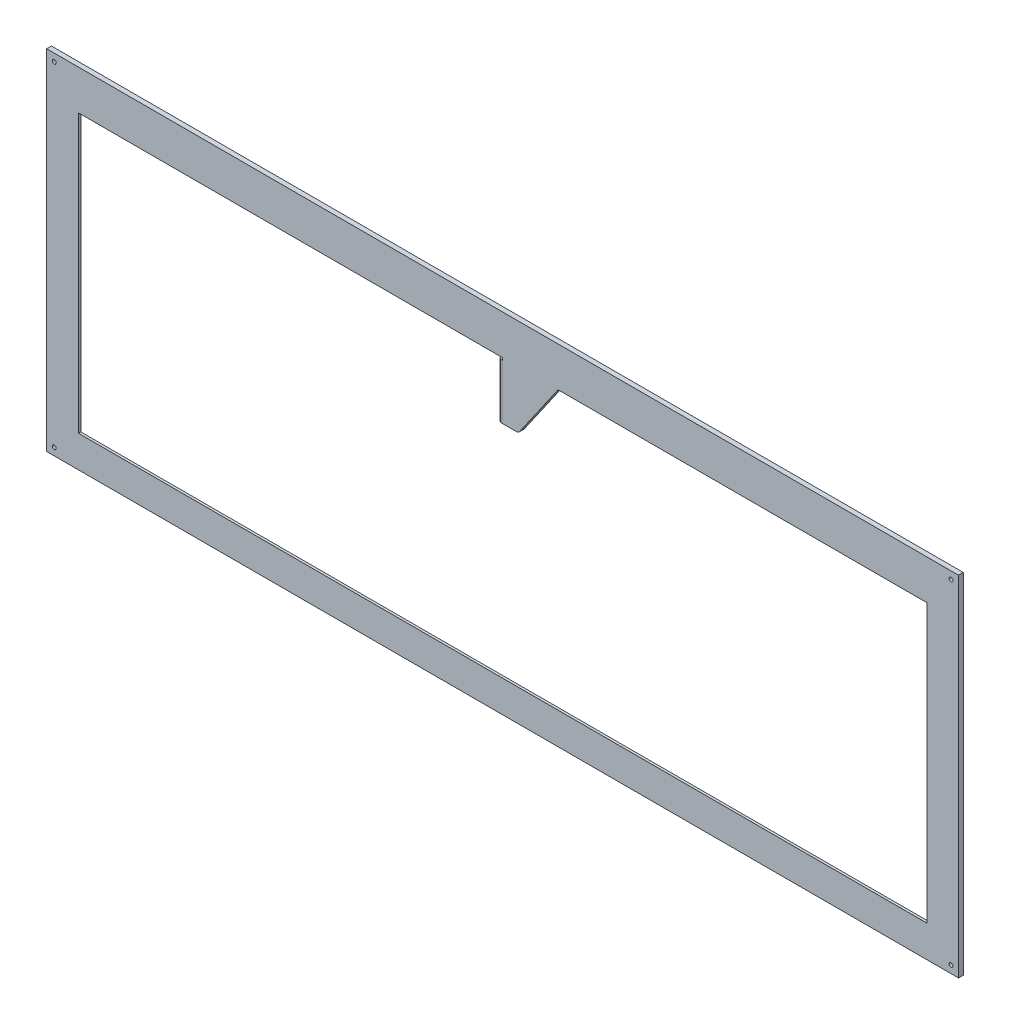
from build123d import *

# Parameters (mm, degrees)
SKETCH1_W           = 1150
SKETCH1_H           = 440
SKETCH1_W_2         = 1070
SKETCH1_H_2         = 350
BOSS_EXTRUDE1_DEPTH = 6
SKETCH3_R           = 2.5
CUT_EXTRUDE2_DEPTH  = 618.483603021
SKETCH2_W           = 1112
SKETCH2_H           = 402
SKETCH2_W_2         = 1070
SKETCH2_H_2         = 350
CUT_EXTRUDE1_DEPTH  = 3
BOSS_EXTRUDE2_DEPTH = 6
SKETCH5_W           = 6
SKETCH5_H           = 69
BOSS_EXTRUDE3_DEPTH = 26
CUT_EXTRUDE3_DEPTH  = 26
FILLET1_R           = 5


with BuildPart() as part:
    # Sketch1 → Boss-Extrude1 (new body)
    with BuildSketch(Plane.XY):
        with Locations((0, 5)):
            Rectangle(SKETCH1_W, SKETCH1_H)
        Rectangle(SKETCH1_W_2, SKETCH1_H_2, mode=Mode.SUBTRACT)
    extrude(amount=BOSS_EXTRUDE1_DEPTH)

    # Sketch3 → Cut-Extrude2 (cut, through all)
    with BuildSketch(Plane(origin=(0, 0, 0), x_dir=(-1, 0, 0), z_dir=(0, 0, -1))):
        with Locations((-565.5, 215.5)):
            Circle(SKETCH3_R)
        with Locations((565.5, 215.5)):
            Circle(SKETCH3_R)
        with Locations((565.5, -205.5)):
            Circle(SKETCH3_R)
        with Locations((-565.5, -205.5)):
            Circle(SKETCH3_R)
    extrude(amount=-CUT_EXTRUDE2_DEPTH, mode=Mode.SUBTRACT)

    # Sketch2 → Cut-Extrude1 (cut)
    with BuildSketch(Plane(origin=(0, 0, 0), x_dir=(-1, 0, 0), z_dir=(0, 0, -1))):
        with Locations((0, 5)):
            Rectangle(SKETCH2_W, SKETCH2_H)
        Rectangle(SKETCH2_W_2, SKETCH2_H_2, mode=Mode.SUBTRACT)
    extrude(amount=-CUT_EXTRUDE1_DEPTH, mode=Mode.SUBTRACT)

    # Sketch4 → Boss-Extrude2 (add)
    with BuildSketch(Plane.XY.offset(6)):
        Polygon((0, 175), (0, 103), (20, 103), (70, 175), align=None)
    extrude(amount=-BOSS_EXTRUDE2_DEPTH)

    # Sketch5 → Boss-Extrude3 (add)
    with BuildSketch(Plane.XY.offset(6)):
        with Locations((-3, 137.5)):
            Rectangle(SKETCH5_W, SKETCH5_H)
    extrude(amount=-BOSS_EXTRUDE3_DEPTH)

    # Sketch6 → Cut-Extrude3 (cut)
    with BuildSketch(Plane(origin=(0, 0, 0), x_dir=(0, 0, -1), z_dir=(1, 0, 0))):
        with BuildLine():
            Line((13, 162), (13, 113))
            ThreePointArc((13, 113), (10, 110), (7, 113))
            Line((7, 113), (7, 162))
            ThreePointArc((7, 162), (10, 165), (13, 162))
        make_face()
    extrude(amount=-CUT_EXTRUDE3_DEPTH, mode=Mode.SUBTRACT)

    # Fillet1
    fillet1_edges = [part.edges().sort_by_distance(p)[0] for p in [
        (20, 103, 3),
        (-3, 103, -20),
        (-3, 172, -20),
        (-6, 137.5, 6),
    ]]
    fillet(fillet1_edges, radius=FILLET1_R)


solid = part.part
